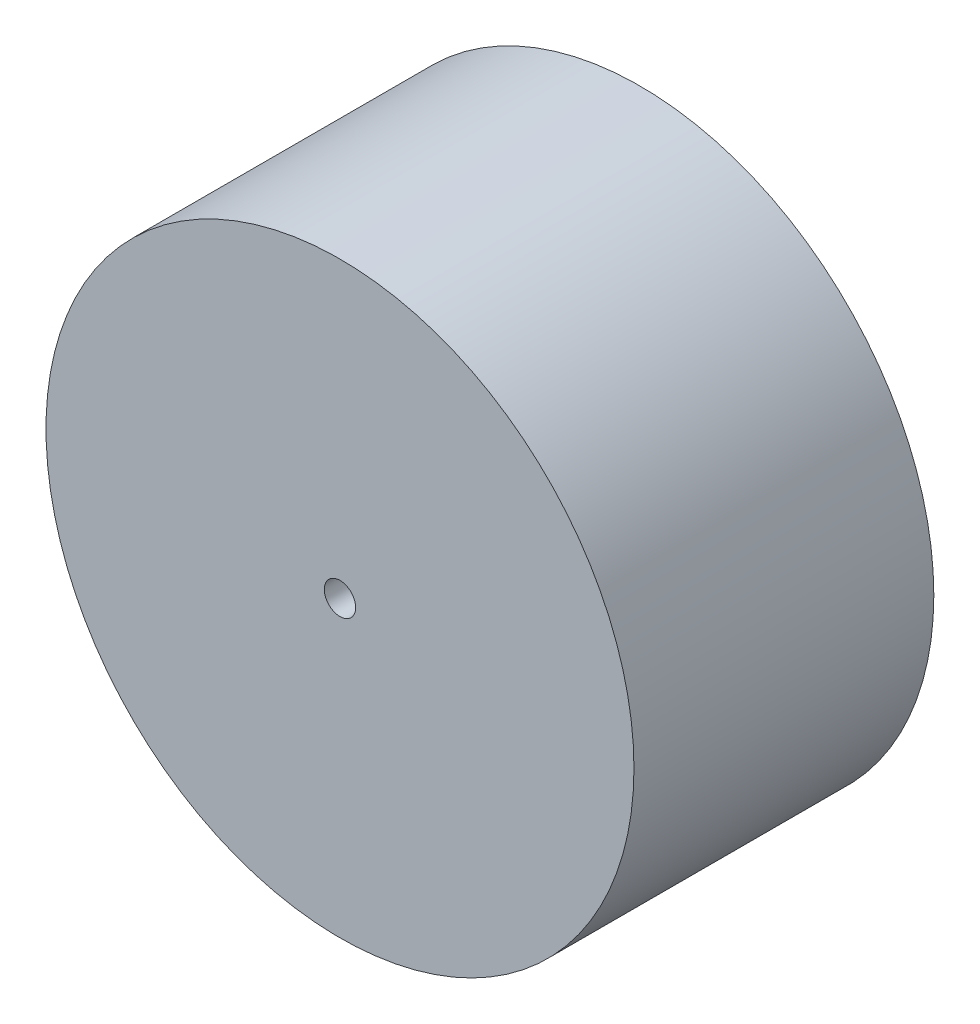
from build123d import *

# Parameters (mm, degrees)
SKETCH_1_R      = 30
SKETCH_1_R_2    = 1.6
EXTRUDE_1_DEPTH = 30.6


with BuildPart() as part:
    # 草图1 → 凸台-拉伸1 (new body)
    with BuildSketch(Plane.XY):
        Circle(SKETCH_1_R)
        Circle(SKETCH_1_R_2, mode=Mode.SUBTRACT)
    extrude(amount=EXTRUDE_1_DEPTH)


solid = part.part
